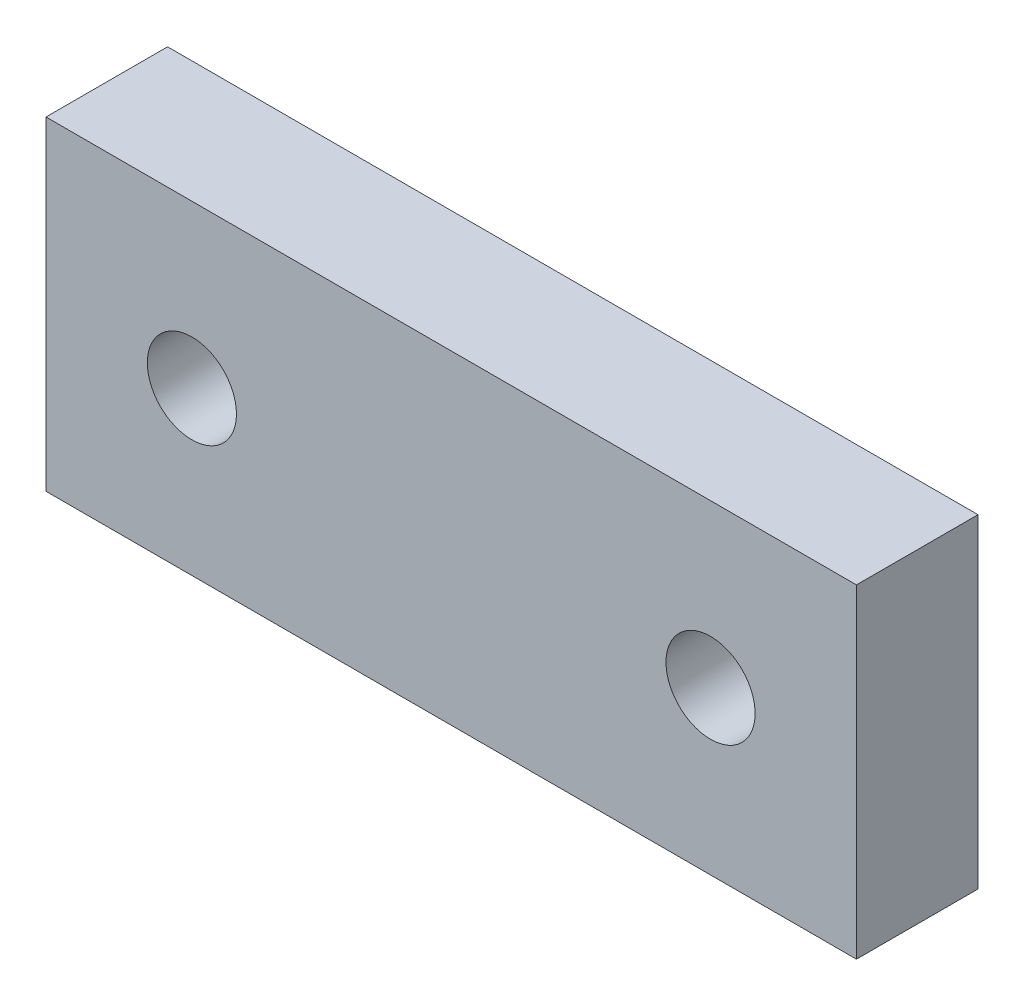
from build123d import *

# Parameters (mm, degrees)
SKETCH_1_W      = 50
SKETCH_1_H      = 20
SKETCH_1_R      = 2.75
EXTRUDE_1_DEPTH = 7.5


with BuildPart() as part:
    # 草图1 → 凸台-拉伸1 (new body)
    with BuildSketch(Plane.XY):
        Rectangle(SKETCH_1_W, SKETCH_1_H)
        with Locations((-16, 0)):
            Circle(SKETCH_1_R, mode=Mode.SUBTRACT)
        with Locations(Location((16, 0, 0), (0, 0, 180))):
            Circle(SKETCH_1_R, mode=Mode.SUBTRACT)
    extrude(amount=EXTRUDE_1_DEPTH)


solid = part.part
